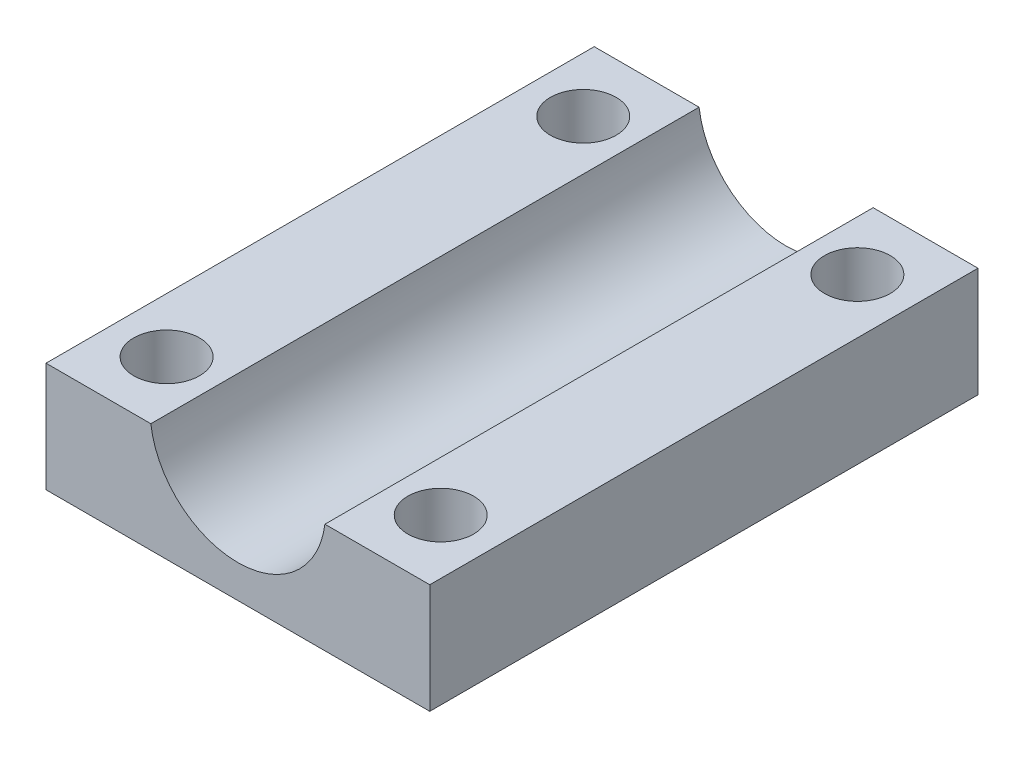
from build123d import *

# Parameters (mm, degrees)
BOSS_EXTRUDE1_DEPTH = 50
SKETCH3_R           = 3
CUT_EXTRUDE1_DEPTH  = 54.909646632


with BuildPart() as part:
    # Sketch2 → Boss-Extrude1 (new body)
    with BuildSketch(Plane.XY):
        with BuildLine():
            Line((-17.5, -11.928580859), (-7.937253933, -11.928580859))
            ThreePointArc((-7.937253933, -11.928580859), (0, -18.928580859), (7.937253933, -11.928580859))
            Line((7.937253933, -11.928580859), (17.5, -11.928580859))
            Line((17.5, -11.928580859), (17.5, -21.928580859))
            Line((17.5, -21.928580859), (-17.5, -21.928580859))
            Line((-17.5, -21.928580859), (-17.5, -11.928580859))
        make_face()
    extrude(amount=-BOSS_EXTRUDE1_DEPTH)

    # Sketch3 → Cut-Extrude1 (cut, through all)
    with BuildSketch(Plane.XZ.offset(21.928580859)):
        with Locations(Location((12.5, -6, 0), (0, 0, 270))):
            Circle(SKETCH3_R)
        with Locations(Location((-12.5, -6, 0), (0, 0, 90))):
            Circle(SKETCH3_R)
        with Locations(Location((-12.5, -44, 0), (0, 0, 270))):
            Circle(SKETCH3_R)
        with Locations(Location((12.5, -44, 0), (0, 0, 90))):
            Circle(SKETCH3_R)
    extrude(amount=-CUT_EXTRUDE1_DEPTH, mode=Mode.SUBTRACT)


solid = part.part
